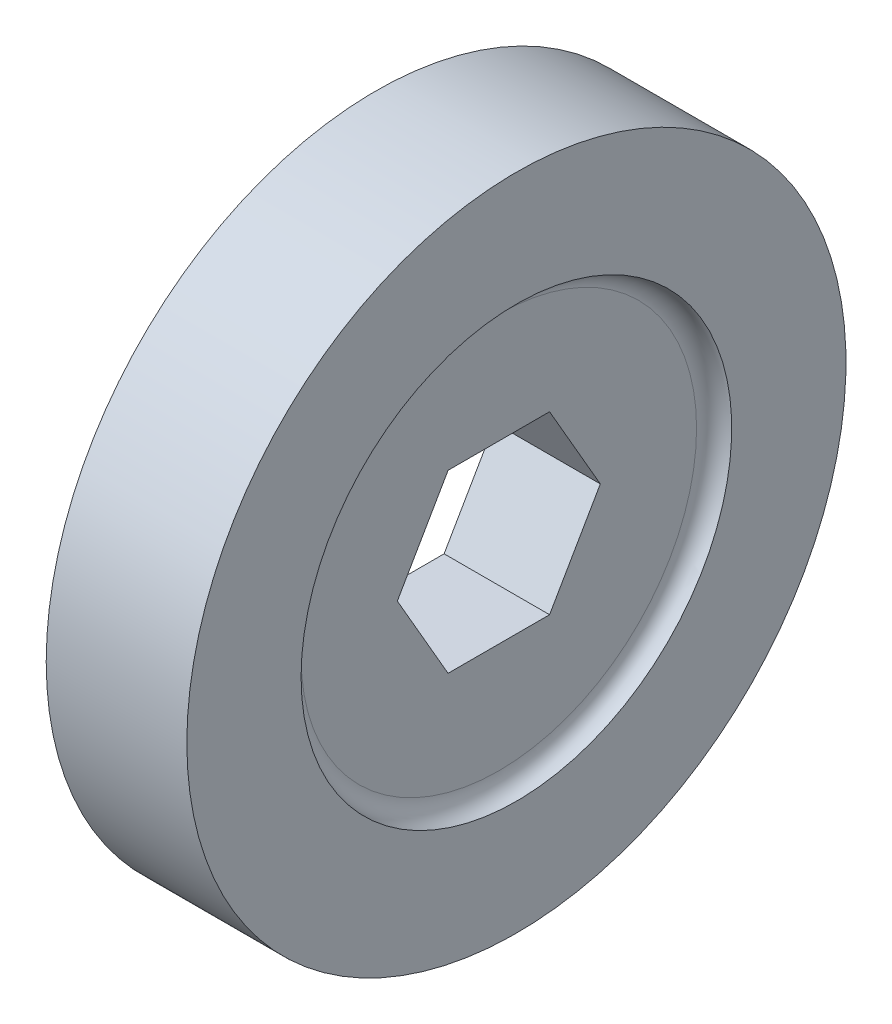
from build123d import *

# Parameters (mm, degrees)
CUT_EXTRUDE1_REACH = 36.83


with BuildPart() as part:
    # Sketch2 → Revolve1 (revolve)
    with BuildSketch(Plane.XY, mode=Mode.PRIVATE) as revolve1_sk:
        with BuildLine():
            Line((-5.08, 23.8125), (-5.08, 15.5575))
            ThreePointArc((-5.08, 15.5575), (-4.181974388, 15.185525612), (-3.81, 14.2875))
            Line((-3.81, 14.2875), (-3.81, 0))
            Line((-3.81, 0), (3.81, 0))
            Line((3.81, 0), (3.81, 14.2875))
            ThreePointArc((3.81, 14.2875), (4.181974388, 15.185525612), (5.08, 15.5575))
            Line((5.08, 15.5575), (5.08, 23.8125))
            Line((5.08, 23.8125), (-5.08, 23.8125))
        make_face()
    revolve(revolve1_sk.sketch.rotate(Axis((-6.869429095, 0, 0), (1, 0, 0)), 90), axis=Axis((-6.869429095, 0, 0), (1, 0, 0)))

    # Sketch3 → Cut-Extrude1 (cut, up to next)
    with BuildSketch(Plane(origin=(3.81, 0, 0), x_dir=(0, 0, -1), z_dir=(1, 0, 0)), mode=Mode.PRIVATE) as cut_extrude1_sk1:
        Polygon((7.332348419, 0), (3.666174209, 6.35), (-3.666174209, 6.35), (-7.332348419, 0), (-3.666174209, -6.35), (3.666174209, -6.35), align=None)
    cut_extrude1_tool1 = extrude(cut_extrude1_sk1.sketch, amount=-CUT_EXTRUDE1_REACH, mode=Mode.PRIVATE) & part.part
    add(cut_extrude1_tool1.solids().sort_by_distance((3.81, 0, 0))[0], mode=Mode.SUBTRACT)


solid = part.part
